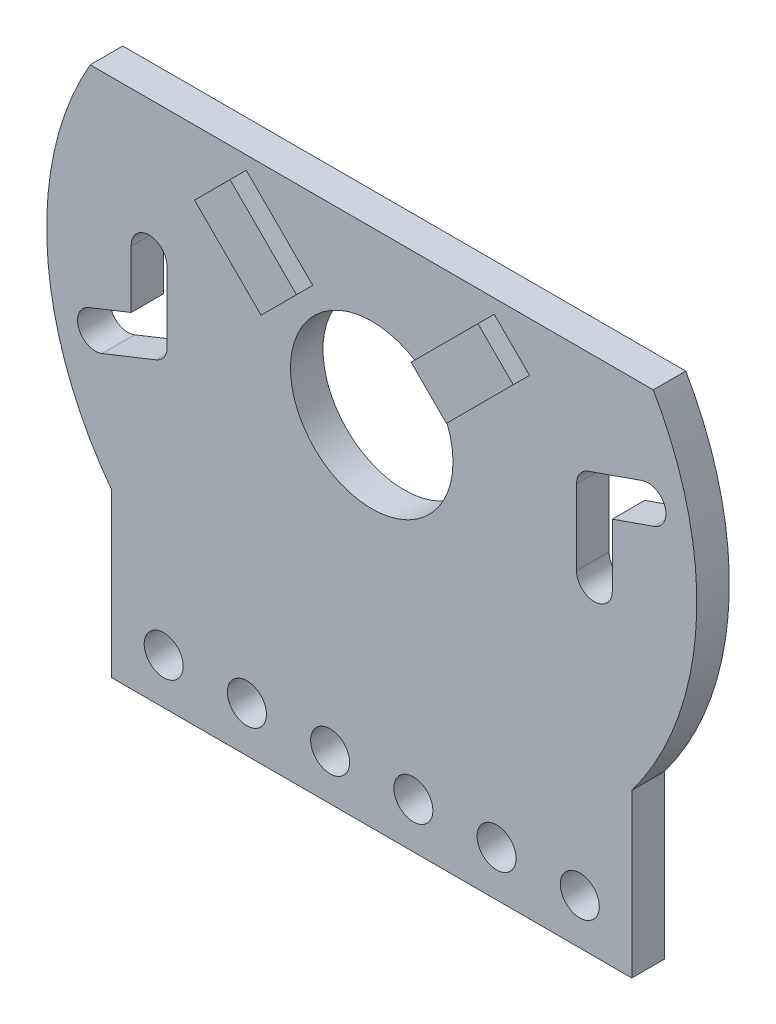
from build123d import *

# Parameters (mm, degrees)
ESQUISSE1_R                = 2.5
ESQUISSE1_R_2              = 0.6
BOSS_EXTRU_1_DEPTH         = 1
ENL_V_MAT_EXTRU_1_DEPTH    = 15.899664426
BOSS_EXTRU_2_DEPTH         = 0.5
BOSS_EXTRU_3_DEPTH         = 0.5
CORTAR_EXTRUIR1_DEPTH      = 15.899664426
CORTAR_EXTRUIR1_DEPTH_BACK = 15.899664426


with BuildPart() as part:
    # Esquisse1 → Boss.-Extru.1 (new body)
    with BuildSketch(Plane.XY):
        with BuildLine():
            Line((-8.351646544, 5.5), (8.351646544, 5.5))
            ThreePointArc((8.351646544, 5.5), (9.995328218, -0.30563675), (8, -6))
            Line((8, -6), (8, -11))
            Line((8, -11), (-8, -11))
            Line((-8, -11), (-8, -6))
            ThreePointArc((-8, -6), (-9.995328218, -0.30563675), (-8.351646544, 5.5))
        make_face()
        Circle(ESQUISSE1_R, mode=Mode.SUBTRACT)
        with Locations((-6.4, -9.6)):
            Circle(ESQUISSE1_R_2, mode=Mode.SUBTRACT)
        with Locations((-3.84, -9.6)):
            Circle(ESQUISSE1_R_2, mode=Mode.SUBTRACT)
        with Locations((-1.28, -9.6)):
            Circle(ESQUISSE1_R_2, mode=Mode.SUBTRACT)
        with Locations((1.28, -9.6)):
            Circle(ESQUISSE1_R_2, mode=Mode.SUBTRACT)
        with Locations((3.84, -9.6)):
            Circle(ESQUISSE1_R_2, mode=Mode.SUBTRACT)
        with Locations((6.4, -9.6)):
            Circle(ESQUISSE1_R_2, mode=Mode.SUBTRACT)
        with BuildLine():
            Line((-6.3, 0.8), (-6.3, -1.444183839))
            ThreePointArc((-6.3, -1.444183839), (-6.419746949, -1.690835185), (-6.641967863, -1.851440553))
            Line((-6.641967863, -1.851440553), (-8.292953638, -2.509553847))
            ThreePointArc((-8.292953638, -2.509553847), (-9.009553847, -2.207046362), (-8.707046362, -1.490446153))
            Line((-8.707046362, -1.490446153), (-7.4, -0.969433434))
            Line((-7.4, -0.969433434), (-7.4, 0.8))
            ThreePointArc((-7.4, 0.8), (-6.85, 1.370822155), (-6.3, 0.8))
        make_face(mode=Mode.SUBTRACT)
        with BuildLine():
            Line((7.4, 1.315402872), (7.4, -1))
            ThreePointArc((7.4, -1), (6.85, -1.55), (6.3, -1))
            Line((6.3, -1), (6.3, 1.315402872))
            ThreePointArc((6.3, 1.315402872), (6.85, 1.865402872), (7.4, 1.315402872))
        make_face(mode=Mode.SUBTRACT)
    extrude(amount=BOSS_EXTRU_1_DEPTH)

    # Esquisse2 → Enlèv. mat.-Extru.1 (cut, through all)
    with BuildSketch(Plane.XY.offset(1)):
        with BuildLine():
            Line((6.668307266, 1.834524968), (8.317330789, 2.411683201))
            ThreePointArc((8.317330789, 2.411683201), (9.018145619, 2.074253838), (8.680716257, 1.373439009))
            Line((8.680716257, 1.373439009), (7.031692734, 0.796280776))
            ThreePointArc((7.031692734, 0.796280776), (6.330877904, 1.133710138), (6.668307266, 1.834524968))
        make_face()
    extrude(amount=-ENL_V_MAT_EXTRU_1_DEPTH, mode=Mode.SUBTRACT)

    # Esquisse3 → Boss.-Extru.2 (add)
    with BuildSketch(Plane.XY.offset(1)):
        Polygon((-4.950824849, 3.498836933), (-2.906168647, 1.454180731), (-1.81491955, 2.545429827), (-3.859575753, 4.59008603), align=None)
    extrude(amount=BOSS_EXTRU_2_DEPTH)

    # Esquisse4 → Boss.-Extru.3 (add)
    with BuildSketch(Plane.XY.offset(1)):
        Polygon((1.711538057, 2.510969329), (3.767681092, 4.567112364), (4.853186772, 3.481606684), (2.797043737, 1.425463649), align=None)
    extrude(amount=BOSS_EXTRU_3_DEPTH)

    # Croquis1 → Cortar-Extruir1 (cut, two sides: drawn at the far end of the back side and taken through both)
    with BuildSketch(Plane.XY.offset(1).offset(-CORTAR_EXTRUIR1_DEPTH_BACK)):
        Polygon((-8.660254038, 5), (8.660254038, 5), (9.520326515, 6.024620039), (-9.576517097, 6.287420639), align=None)
    extrude(amount=CORTAR_EXTRUIR1_DEPTH + CORTAR_EXTRUIR1_DEPTH_BACK, mode=Mode.SUBTRACT)


solid = part.part
